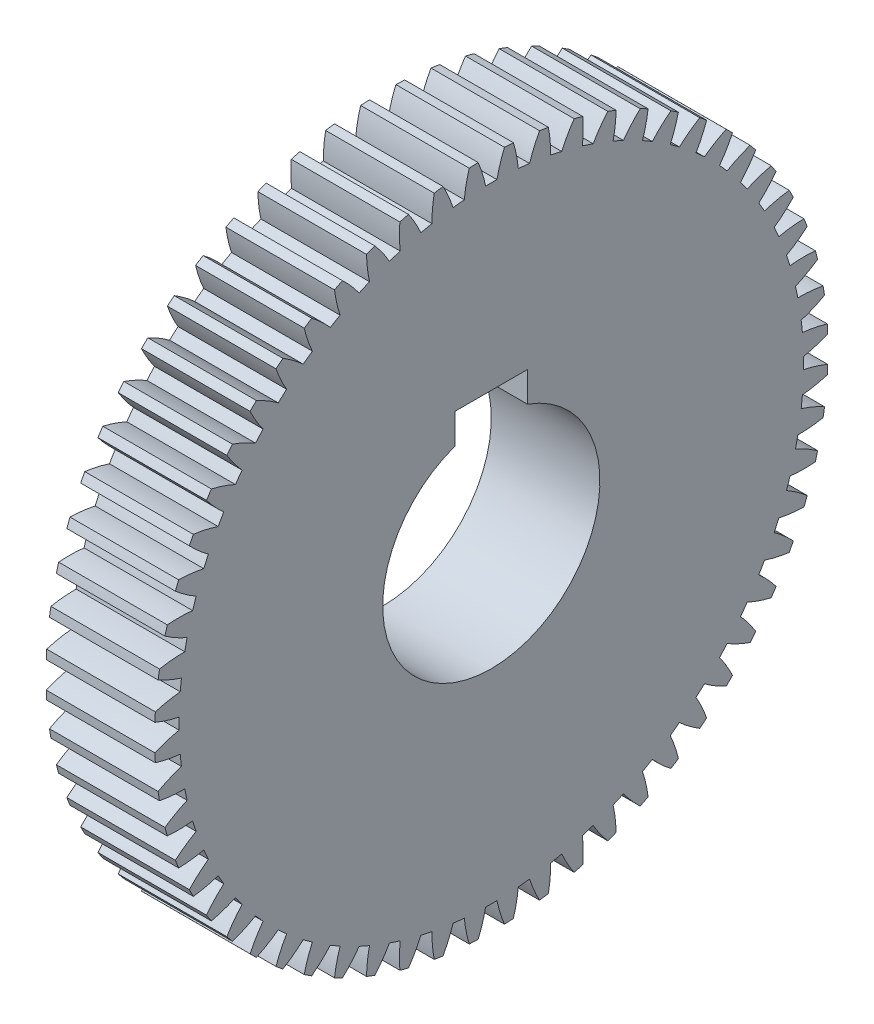
from build123d import *

# Parameters (mm, degrees)
BASPROSKE_W     = 15
BASPROSKE_H     = 46.5
TOOTHCUT_DEPTH  = 68.449981468
TEETHCUTS_COUNT = 60
TEETHCUTS_ANGLE = 354
BORSKE_R        = 15
BORE_DEPTH      = 50.0000508
KEYSKE_W        = 10
KEYSKE_H        = 18.3
KEYWAY_DEPTH    = 50.0000508


with BuildPart() as part:
    # BasProSke → Base-Revolve (revolve)
    with BuildSketch(Plane(origin=(0, 0, 0), x_dir=(1, 0, 0), z_dir=(0, 1, 0)), mode=Mode.PRIVATE) as base_revolve_sk:
        with Locations((7.5, 23.25)):
            Rectangle(BASPROSKE_W, BASPROSKE_H)
    revolve(base_revolve_sk.sketch.rotate(Axis((-10, 0, 0), (1, 0, 0)), 180), axis=Axis((-10, 0, 0), (1, 0, 0)))

    # TooCutSke → ToothCut (cut, through all)
    with BuildSketch(Plane(origin=(0, 0, 0), x_dir=(0, 0, -1), z_dir=(1, 0, 0))):
        with BuildLine():
            ThreePointArc((0.781047762, 43.116926379), (0, 43.124), (-0.781047762, 43.116926379))
            ThreePointArc((-0.781047762, 43.116926379), (-1.222359127, 44.828947247), (-1.829495894, 46.489415892))
            ThreePointArc((-1.829495894, 46.489415892), (0, 46.5254), (1.829495894, 46.489415892))
            ThreePointArc((1.829495894, 46.489415892), (1.222359127, 44.828947247), (0.781047762, 43.116926379))
        make_face()
    toothcut = extrude(amount=TOOTHCUT_DEPTH, mode=Mode.SUBTRACT)

    # TeethCuts: ToothCut ×60 about axis
    teethcuts_axis = Axis((-10, 0, 0), (1, 0, 0))
    for i in range(1, TEETHCUTS_COUNT):
        add(toothcut.rotate(teethcuts_axis, i * TEETHCUTS_ANGLE / (TEETHCUTS_COUNT - 1)), mode=Mode.SUBTRACT)

    # BorSke → Bore (cut, symmetric)
    with BuildSketch(Plane(origin=(0, 0, 0), x_dir=(0, 0, -1), z_dir=(1, 0, 0))):
        with Locations(Location((0, 0, 0), (0, 0, 180))):
            Circle(BORSKE_R)
    extrude(amount=BORE_DEPTH, both=True, mode=Mode.SUBTRACT)

    # KeySke → Keyway (cut, symmetric)
    with BuildSketch(Plane(origin=(0, 0, 0), x_dir=(0, 0, -1), z_dir=(1, 0, 0))):
        with Locations((0, 9.15)):
            Rectangle(KEYSKE_W, KEYSKE_H)
    extrude(amount=KEYWAY_DEPTH, both=True, mode=Mode.SUBTRACT)


solid = part.part
